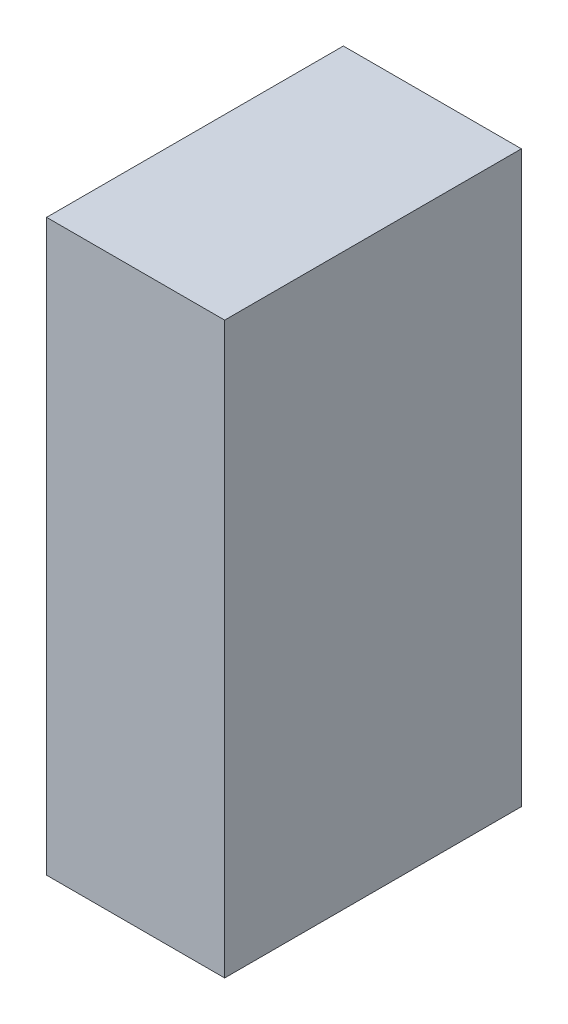
from build123d import *

# Parameters (mm, degrees)
SKETCH1_W           = 15
SKETCH1_H           = 25
BOSS_EXTRUDE1_DEPTH = 48


with BuildPart() as part:
    # Sketch1 → Boss-Extrude1 (new body)
    with BuildSketch(Plane(origin=(0, 0, 0), x_dir=(1, 0, 0), z_dir=(0, 1, 0))):
        with Locations((7.5, 12.5)):
            Rectangle(SKETCH1_W, SKETCH1_H)
    extrude(amount=BOSS_EXTRUDE1_DEPTH)


solid = part.part
